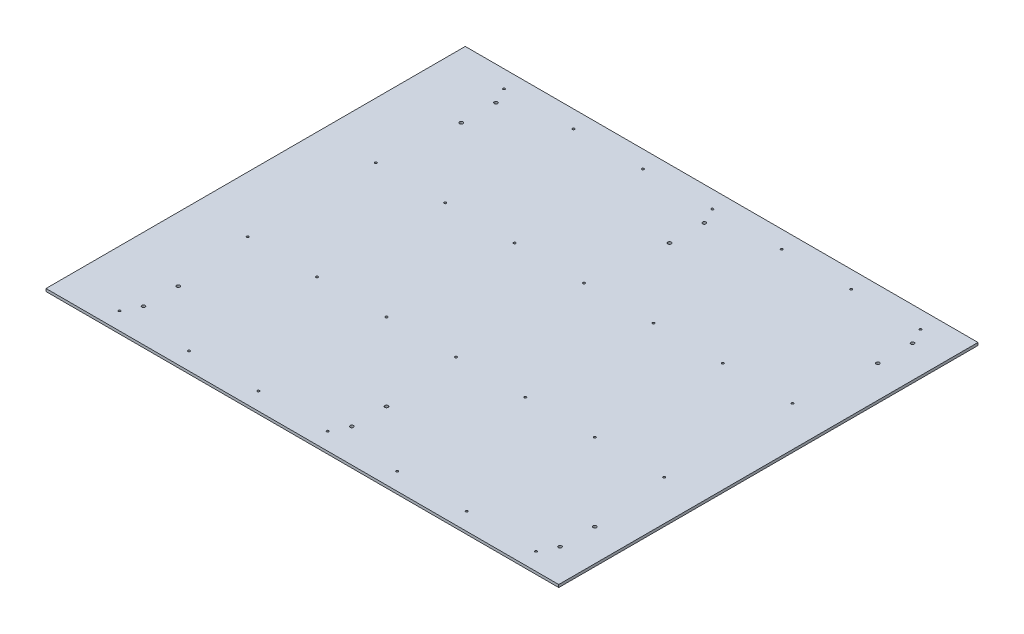
from build123d import *

# Parameters (mm, degrees)
SKETCH1_W                        = 1219.2
SKETCH1_H                        = 996.95
BOSS_EXTRUDE1_DEPTH              = 6.35
F_13_64_0_20313_DIAMETER_HOLE1_D = 5.159502
LPATTERN1_COUNT                  = 4
LPATTERN1_PITCH                  = 304.8
LPATTERN1_COUNT_DIR2             = 7
LPATTERN1_PITCH_DIR2             = 165.1
SKETCH4_R                        = 3.96875
CUT_EXTRUDE1_DEPTH               = 788.483211329
LPATTERN2_COUNT                  = 3
LPATTERN2_PITCH                  = 495.3
LPATTERN2_COPY_1_SKETCH_R        = 3.96875
LPATTERN2_COPY_1_DEPTH           = 788.483211329
LPATTERN2_COPY_2_SKETCH_R        = 3.96875
LPATTERN2_COPY_2_DEPTH           = 788.483211329


with BuildPart() as part:
    # Sketch1 → Boss-Extrude1 (new body)
    with BuildSketch(Plane(origin=(0, 0, 0), x_dir=(1, 0, 0), z_dir=(0, 1, 0))):
        Rectangle(SKETCH1_W, SKETCH1_H)
    extrude(amount=BOSS_EXTRUDE1_DEPTH)

    # 13/64 (0.20313) Diameter Hole1 (through all)
    with Locations(Plane(origin=(0, 6.35, 0), x_dir=(1, 0, 0), z_dir=(0, 1, 0))):
        with Locations((514.35, -457.2)):
            f_13_64_0_20313_diameter_hole1 = Hole(F_13_64_0_20313_DIAMETER_HOLE1_D / 2)

    # LPattern1: 13_64 _0.20313_ Diameter Hole1 4 × 7
    with Locations(*[(-j * LPATTERN1_PITCH_DIR2, 0, -i * LPATTERN1_PITCH) for i in range(LPATTERN1_COUNT) for j in range(LPATTERN1_COUNT_DIR2) if (i, j) != (0, 0)]):
        add(f_13_64_0_20313_diameter_hole1, mode=Mode.SUBTRACT)

    # Sketch4 → Cut-Extrude1 (cut, through all)
    with BuildSketch(Plane(origin=(0, 6.35, 0), x_dir=(1, 0, 0), z_dir=(0, 1, 0))):
        with Locations(Location((533.4, 419.1, 0), (0, 0, 270))):
            Circle(SKETCH4_R)
        with Locations(Location((533.4, 336.55, 0), (0, 0, 270))):
            Circle(SKETCH4_R)
    cut_extrude1 = extrude(amount=-CUT_EXTRUDE1_DEPTH, mode=Mode.SUBTRACT)

    # Mirror1: Cut-Extrude1 across plane
    add(cut_extrude1.mirror(Plane.XY), mode=Mode.SUBTRACT)

    # LPattern2: Cut-Extrude1 ×3
    with Locations(*[(-i * LPATTERN2_PITCH, 0, 0) for i in range(1, LPATTERN2_COUNT)]):
        add(cut_extrude1, mode=Mode.SUBTRACT)

    # LPattern2 copy 1 sketch → LPattern2 copy 1 (cut, through all)
    with BuildSketch(Plane(origin=(-495.3, 6.35, 0), x_dir=(1, 0, 0), z_dir=(0, 1, 0))):
        with Locations((533.4, -419.1)):
            Circle(LPATTERN2_COPY_1_SKETCH_R)
        with Locations((533.4, -336.55)):
            Circle(LPATTERN2_COPY_1_SKETCH_R)
    extrude(amount=-LPATTERN2_COPY_1_DEPTH, mode=Mode.SUBTRACT)

    # LPattern2 copy 2 sketch → LPattern2 copy 2 (cut, through all)
    with BuildSketch(Plane(origin=(-990.6, 6.35, 0), x_dir=(1, 0, 0), z_dir=(0, 1, 0))):
        with Locations((533.4, -419.1)):
            Circle(LPATTERN2_COPY_2_SKETCH_R)
        with Locations((533.4, -336.55)):
            Circle(LPATTERN2_COPY_2_SKETCH_R)
    extrude(amount=-LPATTERN2_COPY_2_DEPTH, mode=Mode.SUBTRACT)


solid = part.part
